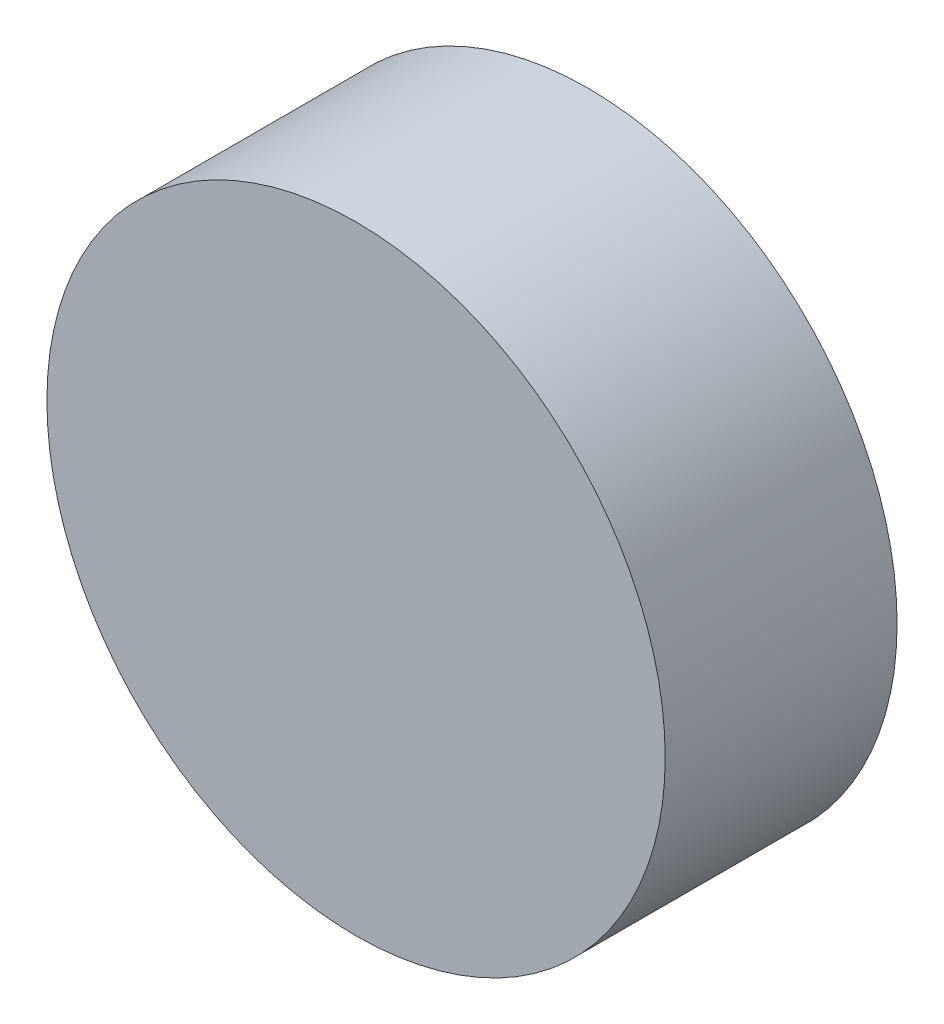
from build123d import *

# Parameters (mm, degrees)
SKETCH2_R           = 5
BOSS_EXTRUDE1_DEPTH = 1
SKETCH3_R           = 8
BOSS_EXTRUDE2_DEPTH = 6


with BuildPart() as part:
    # Sketch2 → Boss-Extrude1 (new body)
    with BuildSketch(Plane.XY):
        with Locations((15, 15)):
            Circle(SKETCH2_R)
    extrude(amount=BOSS_EXTRUDE1_DEPTH)

    # Sketch3 → Boss-Extrude2 (add)
    with BuildSketch(Plane.XY.offset(1)):
        with Locations((15, 15)):
            Circle(SKETCH3_R)
    extrude(amount=BOSS_EXTRUDE2_DEPTH)


solid = part.part
